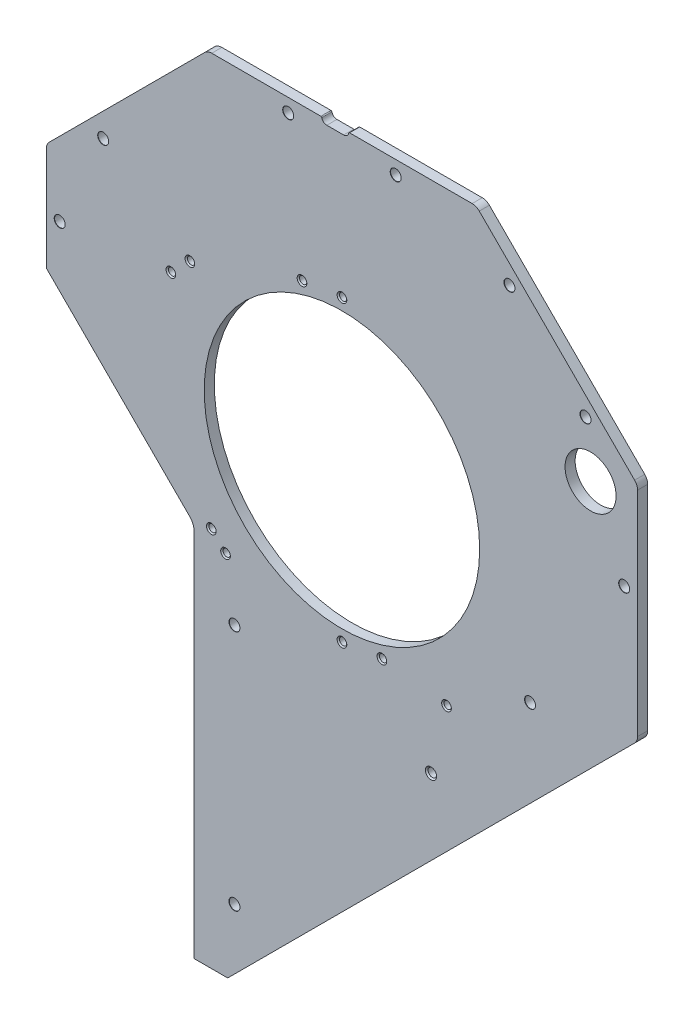
from build123d import *

# Parameters (mm, degrees)
SKETCH1_R                            = 65.0875
BOSS_EXTRUDE1_DEPTH                  = 4.7752
SKETCH5_R                            = 12.065
CUT_EXTRUDE2_DEPTH                   = 274.386896239
F_8_32_TAPPED_HOLE1_AT_2_COUNT       = 2
F_8_32_TAPPED_HOLE1_AT_2_PITCH       = 12.7
F_8_32_TAPPED_HOLE1_AT_3_COUNT       = 2
F_8_32_TAPPED_HOLE1_AT_3_PITCH       = 171.45
F_8_32_TAPPED_HOLE1_AT_4_COUNT       = 2
F_8_32_TAPPED_HOLE1_AT_4_PITCH       = 104.89298661
F_8_32_TAPPED_HOLE1_AT_5_COUNT       = 2
F_8_32_TAPPED_HOLE1_AT_5_PITCH       = 112.388811988
F_8_32_TAPPED_HOLE2_AT_2_COUNT       = 2
F_8_32_TAPPED_HOLE2_AT_2_PITCH       = 19.05
CIRPATTERN1_COUNT                    = 2
F_7_0_201_DIAMETER_HOLE1_AT_2_COUNT  = 2
F_7_0_201_DIAMETER_HOLE1_AT_2_PITCH  = 104.778276415
F_7_0_201_DIAMETER_HOLE1_AT_3_COUNT  = 2
F_7_0_201_DIAMETER_HOLE1_AT_3_PITCH  = 186.786089217
F_7_0_201_DIAMETER_HOLE1_AT_4_COUNT  = 2
F_7_0_201_DIAMETER_HOLE1_AT_4_PITCH  = 234.95
F_7_0_201_DIAMETER_HOLE1_AT_5_COUNT  = 2
F_7_0_201_DIAMETER_HOLE1_AT_5_PITCH  = 157.21861372
F_7_0_201_DIAMETER_HOLE1_AT_6_COUNT  = 2
F_7_0_201_DIAMETER_HOLE1_AT_6_PITCH  = 194.790842957
F_7_0_201_DIAMETER_HOLE1_AT_7_COUNT  = 2
F_7_0_201_DIAMETER_HOLE1_AT_7_PITCH  = 345.068605498
F_7_0_201_DIAMETER_HOLE1_AT_8_COUNT  = 2
F_7_0_201_DIAMETER_HOLE1_AT_8_PITCH  = 148.455325494
F_7_0_201_DIAMETER_HOLE1_AT_9_COUNT  = 2
F_7_0_201_DIAMETER_HOLE1_AT_9_PITCH  = 56.772687292
F_7_0_201_DIAMETER_HOLE1_AT_10_COUNT = 2
F_7_0_201_DIAMETER_HOLE1_AT_10_PITCH = 50.8
FILLET1_R                            = 4.7752
CUT_EXTRUDE4_REACH                   = 275.387


with BuildPart() as part:
    # Sketch1 → Boss-Extrude1 (new body)
    with BuildSketch(Plane.XY):
        with BuildLine():
            Line((-63.5, 139.7), (-139.7, 63.5))
            Line((-139.7, 63.5), (-139.7, 12.7))
            Line((-139.7, 12.7), (-71.933056572, -55.066943428))
            ThreePointArc((-71.933056572, -55.066943428), (-70.391368765, -57.374242285), (-69.85, -60.095886856))
            Line((-69.85, -60.095886856), (-69.85, -234.95))
            Line((-69.85, -234.95), (-53.975, -234.95))
            Line((-53.975, -234.95), (139.7, -41.275))
            Line((139.7, -41.275), (139.7, 63.5))
            Line((139.7, 63.5), (63.5, 139.7))
            Line((63.5, 139.7), (-63.5, 139.7))
        make_face()
        Circle(SKETCH1_R, mode=Mode.SUBTRACT)
    extrude(amount=BOSS_EXTRUDE1_DEPTH)

    # Sketch5 → Cut-Extrude2 (cut, through all)
    with BuildSketch(Plane.XY):
        with Locations((117.475, 53.975)):
            Circle(SKETCH5_R)
    extrude(amount=CUT_EXTRUDE2_DEPTH, mode=Mode.SUBTRACT)

    # Sketch6 → #8-32 Tapped Hole1 (revolve, cut)
    with BuildSketch(Plane(origin=(-71.842048969, 49.391408666, 0), x_dir=(0, 1, 0), z_dir=(1, 0, 0))):
        Polygon((0, 0), (0, 4.7752), (2.286, 4.7752), (1.7272, 4.2164), (1.7272, 0.5588), (2.286, 0), align=None)
    f_8_32_tapped_hole1 = revolve(axis=Axis((-71.842048969, 49.391408666, -6.35), (0, 0, 1)), mode=Mode.SUBTRACT)

    # #8-32 Tapped Hole1 at 2: #8-32 Tapped Hole1 ×2
    with Locations(*[Vector(-0.7071067811865428, -0.7071067811865523, 0) * (i * F_8_32_TAPPED_HOLE1_AT_2_PITCH) for i in range(1, F_8_32_TAPPED_HOLE1_AT_2_COUNT)]):
        add(f_8_32_tapped_hole1, mode=Mode.SUBTRACT)

    # #8-32 Tapped Hole1 at 3: #8-32 Tapped Hole1 ×2
    with Locations(*[Vector(0.7071067811865512, -0.7071067811865439, 0) * (i * F_8_32_TAPPED_HOLE1_AT_3_PITCH) for i in range(1, F_8_32_TAPPED_HOLE1_AT_3_COUNT)]):
        add(f_8_32_tapped_hole1, mode=Mode.SUBTRACT)

    # #8-32 Tapped Hole1 at 4: #8-32 Tapped Hole1 ×2
    with Locations(*[Vector(0.09640080542168707, -0.9953425966540617, 0) * (i * F_8_32_TAPPED_HOLE1_AT_4_PITCH) for i in range(1, F_8_32_TAPPED_HOLE1_AT_4_COUNT)]):
        add(f_8_32_tapped_hole1, mode=Mode.SUBTRACT)

    # #8-32 Tapped Hole1 at 5: #8-32 Tapped Hole1 ×2
    with Locations(*[Vector(0.1497391036814564, -0.9887255437322706, 0) * (i * F_8_32_TAPPED_HOLE1_AT_5_PITCH) for i in range(1, F_8_32_TAPPED_HOLE1_AT_5_COUNT)]):
        add(f_8_32_tapped_hole1, mode=Mode.SUBTRACT)

    # Sketch16 → #8-32 Tapped Hole2 (revolve, cut)
    with BuildSketch(Plane(origin=(-18.875314701, 67.922533963, 0), x_dir=(0, 1, 0), z_dir=(1, 0, 0))):
        Polygon((0, 0), (0, 4.7752), (2.286, 4.7752), (1.7272, 4.2164), (1.7272, 0.5588), (2.286, 0), align=None)
    f_8_32_tapped_hole2 = revolve(axis=Axis((-18.875314701, 67.922533963, -6.35), (0, 0, 1)), mode=Mode.SUBTRACT)

    # #8-32 Tapped Hole2 at 2: #8-32 Tapped Hole2 ×2
    with Locations(*[Vector(0.990830168044299, 0.13511320473331287, 0) * (i * F_8_32_TAPPED_HOLE2_AT_2_PITCH) for i in range(1, F_8_32_TAPPED_HOLE2_AT_2_COUNT)]):
        add(f_8_32_tapped_hole2, mode=Mode.SUBTRACT)

    # CirPattern1: #8-32 Tapped Hole2 ×2 about axis
    cirpattern1_axis = Axis((0, 0, 0), (0, 0, 1))
    for i in range(1, CIRPATTERN1_COUNT):
        add(f_8_32_tapped_hole2.rotate(cirpattern1_axis, i * 360 / CIRPATTERN1_COUNT), mode=Mode.SUBTRACT)

    # CirPattern1 copy 1 sketch → CirPattern1 copy 1 (revolve, cut)
    with BuildSketch(Plane(origin=(0, -70.496440513, 0), x_dir=(0, -1, 0), z_dir=(-1, 0, 0))):
        Polygon((0, 0), (0, 4.7752), (2.286, 4.7752), (1.7272, 4.2164), (1.7272, 0.5588), (2.286, 0), align=None)
    revolve(axis=Axis((0, -70.496440513, -6.35), (0, 0, 1)), mode=Mode.SUBTRACT)

    # Sketch9 → #7 (0.201) Diameter Hole1 (revolve, cut)
    with BuildSketch(Plane(origin=(25.4, 133.35, 0), x_dir=(0, 1, 0), z_dir=(1, 0, 0))):
        Polygon((0, 0), (0, 4.7752), (2.6035, 4.7752), (2.5527, 4.652557951), (2.5527, 0.122642049), (2.6035, 0), align=None)
    f_7_0_201_diameter_hole1 = revolve(axis=Axis((25.4, 133.35, -6.35), (0, 0, 1)), mode=Mode.SUBTRACT)

    # #7 (0.201) Diameter Hole1 at 2: #7 (0.201) Diameter Hole1 ×2
    with Locations(*[Vector(0.8558108345517201, -0.5172889090864876, 0) * (i * F_7_0_201_DIAMETER_HOLE1_AT_2_PITCH) for i in range(1, F_7_0_201_DIAMETER_HOLE1_AT_2_COUNT)]):
        add(f_7_0_201_diameter_hole1, mode=Mode.SUBTRACT)

    # #7 (0.201) Diameter Hole1 at 3: #7 (0.201) Diameter Hole1 ×2
    with Locations(*[Vector(-0.8499026917123796, -0.5269396688616753, 0) * (i * F_7_0_201_DIAMETER_HOLE1_AT_3_PITCH) for i in range(1, F_7_0_201_DIAMETER_HOLE1_AT_3_COUNT)]):
        add(f_7_0_201_diameter_hole1, mode=Mode.SUBTRACT)

    # #7 (0.201) Diameter Hole1 at 4: #7 (0.201) Diameter Hole1 ×2
    with Locations(*[Vector(-0.32432432432432445, -0.9459459459459459, 0) * (i * F_7_0_201_DIAMETER_HOLE1_AT_4_PITCH) for i in range(1, F_7_0_201_DIAMETER_HOLE1_AT_4_COUNT)]):
        add(f_7_0_201_diameter_hole1, mode=Mode.SUBTRACT)

    # #7 (0.201) Diameter Hole1 at 5: #7 (0.201) Diameter Hole1 ×2
    with Locations(*[Vector(0.6866235329637165, -0.7270131525498176, 0) * (i * F_7_0_201_DIAMETER_HOLE1_AT_5_PITCH) for i in range(1, F_7_0_201_DIAMETER_HOLE1_AT_5_COUNT)]):
        add(f_7_0_201_diameter_hole1, mode=Mode.SUBTRACT)

    # #7 (0.201) Diameter Hole1 at 6: #7 (0.201) Diameter Hole1 ×2
    with Locations(*[Vector(0.3259906833194041, -0.9453729816262723, 0) * (i * F_7_0_201_DIAMETER_HOLE1_AT_6_PITCH) for i in range(1, F_7_0_201_DIAMETER_HOLE1_AT_6_COUNT)]):
        add(f_7_0_201_diameter_hole1, mode=Mode.SUBTRACT)

    # #7 (0.201) Diameter Hole1 at 7: #7 (0.201) Diameter Hole1 ×2
    with Locations(*[Vector(-0.22082565259779527, -0.9753132989735954, 0) * (i * F_7_0_201_DIAMETER_HOLE1_AT_7_PITCH) for i in range(1, F_7_0_201_DIAMETER_HOLE1_AT_7_COUNT)]):
        add(f_7_0_201_diameter_hole1, mode=Mode.SUBTRACT)

    # #7 (0.201) Diameter Hole1 at 8: #7 (0.201) Diameter Hole1 ×2
    with Locations(*[Vector(-0.9309693618526736, -0.3650973120849093, 0) * (i * F_7_0_201_DIAMETER_HOLE1_AT_8_PITCH) for i in range(1, F_7_0_201_DIAMETER_HOLE1_AT_8_COUNT)]):
        add(f_7_0_201_diameter_hole1, mode=Mode.SUBTRACT)

    # #7 (0.201) Diameter Hole1 at 9: #7 (0.201) Diameter Hole1 ×2
    with Locations(*[Vector(0.9467467942991173, -0.321979048207092, 0) * (i * F_7_0_201_DIAMETER_HOLE1_AT_9_PITCH) for i in range(1, F_7_0_201_DIAMETER_HOLE1_AT_9_COUNT)]):
        add(f_7_0_201_diameter_hole1, mode=Mode.SUBTRACT)

    # #7 (0.201) Diameter Hole1 at 10: #7 (0.201) Diameter Hole1 ×2
    with Locations(*[(-i * F_7_0_201_DIAMETER_HOLE1_AT_10_PITCH, 0, 0) for i in range(1, F_7_0_201_DIAMETER_HOLE1_AT_10_COUNT)]):
        add(f_7_0_201_diameter_hole1, mode=Mode.SUBTRACT)

    # Sketch11 → #10-32 Tapped Hole1 (revolve, cut)
    with BuildSketch(Plane(origin=(42.0624, -103.1875, 0), x_dir=(0, 1, 0), z_dir=(1, 0, 0))):
        Polygon((0, 0), (0, 4.7752), (2.6543, 4.7752), (2.0193, 4.1402), (2.0193, 0.5207), (2.54, 0), align=None)
    revolve(axis=Axis((42.0624, -103.1875, -6.35), (0, 0, 1)), mode=Mode.SUBTRACT)

    # Fillet1
    fillet1_edges = [part.edges().sort_by_distance(p)[0] for p in [
        (-139.7, 63.5, 2.3876),
        (-63.5, 139.7, 2.3876),
        (63.5, 139.7, 2.3876),
        (139.7, 63.5, 2.3876),
        (139.7, -41.275, 2.3876),
    ]]
    fillet(fillet1_edges, radius=FILLET1_R)

    # Sketch13 → Cut-Extrude4 (cut, up to next)
    with BuildSketch(Plane.XY.offset(4.7752), mode=Mode.PRIVATE) as cut_extrude4_sk1:
        with BuildLine():
            Line((3.625876594, 139.7), (9.926476513, 140.251231066))
            Line((9.926476513, 140.251231066), (9.926476513, 142.770744163))
            Line((9.926476513, 142.770744163), (-16.276476513, 142.770744163))
            Line((-16.276476513, 142.770744163), (-16.276476513, 140.251231066))
            Line((-16.276476513, 140.251231066), (-9.975876594, 139.7))
            ThreePointArc((-9.975876594, 139.7), (-9.686584819, 139.577074227), (-9.525, 139.30746187))
            ThreePointArc((-9.525, 139.30746187), (-8.667649526, 137.945233031), (-7.148271788, 137.414))
            Line((-7.148271788, 137.414), (0.798271788, 137.414))
            ThreePointArc((0.798271788, 137.414), (2.317649526, 137.945233031), (3.175, 139.30746187))
            ThreePointArc((3.175, 139.30746187), (3.336584819, 139.577074227), (3.625876594, 139.7))
        make_face()
    cut_extrude4_tool1 = extrude(cut_extrude4_sk1.sketch, amount=-CUT_EXTRUDE4_REACH, mode=Mode.PRIVATE) & part.part
    add(cut_extrude4_tool1.solids().sort_by_distance((-3.175, 140.603778, 4.7752))[0], mode=Mode.SUBTRACT)


solid = part.part
